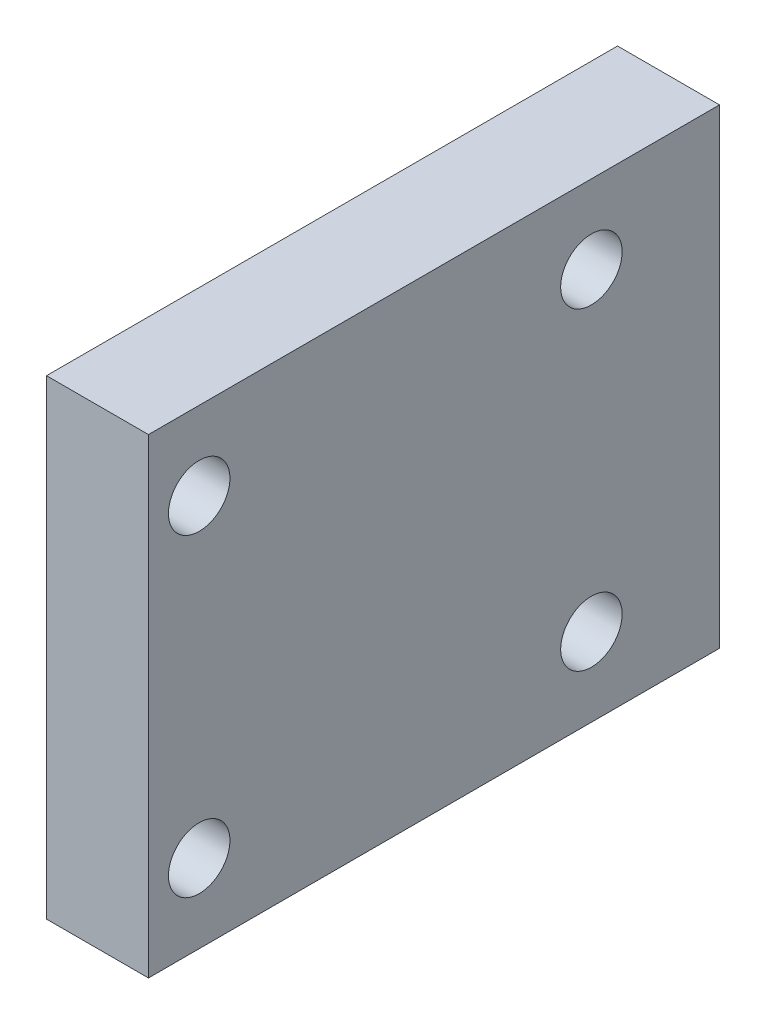
from build123d import *

# Parameters (mm, degrees)
SKETCH2_W                  = 46.228
SKETCH2_H                  = 38.1
BOSS_EXTRUDE1_DEPTH        = 8.255
F_10_CLEARANCE_HOLE1_D     = 4.9784
F_10_CLEARANCE_HOLE1_DEPTH = 25.4
F_10_CLEARANCE_HOLE1_TIP   = 1.495662253


with BuildPart() as part:
    # Sketch2 → Boss-Extrude1 (new body)
    with BuildSketch(Plane(origin=(-488.965433296, 0, 0), x_dir=(0, 0, -1), z_dir=(1, 0, 0))):
        with Locations((171.873330939, 147.533779805)):
            Rectangle(SKETCH2_W, SKETCH2_H)
    extrude(amount=BOSS_EXTRUDE1_DEPTH)

    # #10 Clearance Hole1
    with Locations(Plane.ZY.offset(488.965433296)):
        with Locations((-184.616110941, 160.233779805), (-152.866110941, 160.233779805), (-152.866110941, 134.833779805), (-184.616110941, 134.833779805)):
            Hole(F_10_CLEARANCE_HOLE1_D / 2, depth=F_10_CLEARANCE_HOLE1_DEPTH)
            with Locations((0, 0, -(F_10_CLEARANCE_HOLE1_DEPTH + F_10_CLEARANCE_HOLE1_TIP / 2))):  # 118° drill point
                Cone(0, F_10_CLEARANCE_HOLE1_D / 2, F_10_CLEARANCE_HOLE1_TIP, mode=Mode.SUBTRACT)


solid = part.part
